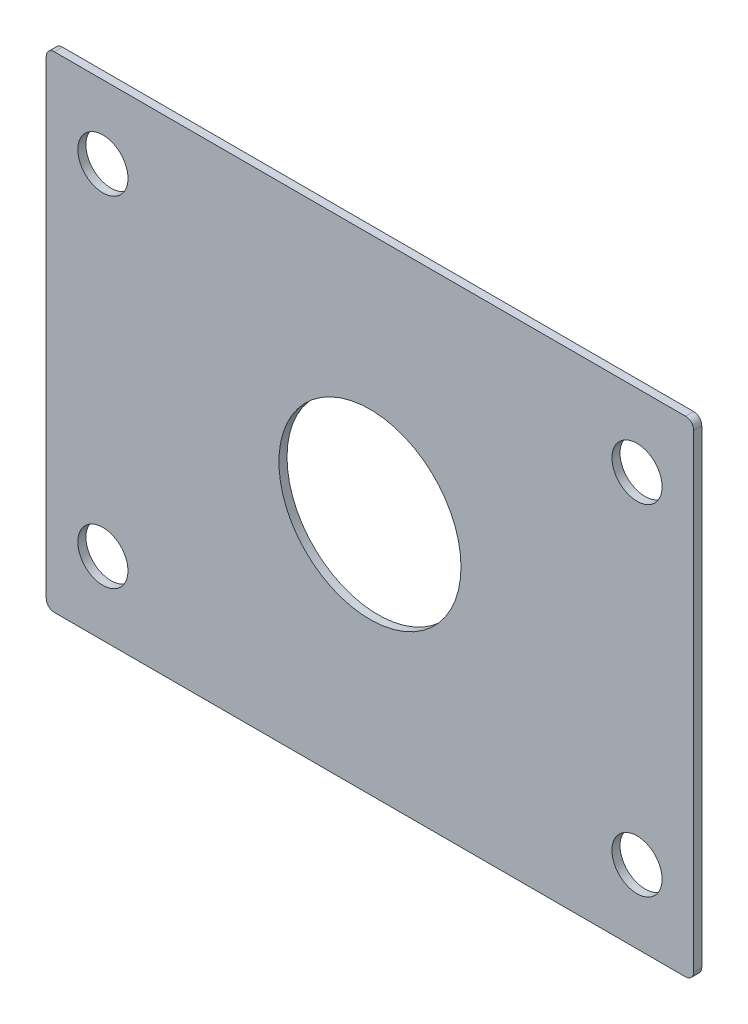
from build123d import *

# Parameters (mm, degrees)
SKETCH1_W           = 80
SKETCH1_H           = 60
BOSS_EXTRUDE1_DEPTH = 1
SKETCH2_R           = 3.1
SKETCH2_R_2         = 11.25
CUT_EXTRUDE1_DEPTH  = 10
FILLET1_R           = 1


with BuildPart() as part:
    # Sketch1 → Boss-Extrude1 (new body)
    with BuildSketch(Plane.XY):
        Rectangle(SKETCH1_W, SKETCH1_H)
    extrude(amount=BOSS_EXTRUDE1_DEPTH)

    # Sketch2 → Cut-Extrude1 (cut)
    with BuildSketch(Plane.XY.offset(1)):
        with Locations((-33, 21)):
            Circle(SKETCH2_R)
        with Locations(Location((33, 21, 0), (0, 0, 180))):
            Circle(SKETCH2_R)
        with Locations((33, -21)):
            Circle(SKETCH2_R)
        with Locations(Location((-33, -21, 0), (0, 0, 180))):
            Circle(SKETCH2_R)
        Circle(SKETCH2_R_2)
    extrude(amount=-CUT_EXTRUDE1_DEPTH, mode=Mode.SUBTRACT)

    # Fillet1
    fillet1_edges = [part.edges().sort_by_distance(p)[0] for p in [
        (-40, 30, 0.5),
        (40, 30, 0.5),
        (40, -30, 0.5),
        (-40, -30, 0.5),
    ]]
    fillet(fillet1_edges, radius=FILLET1_R)


solid = part.part
